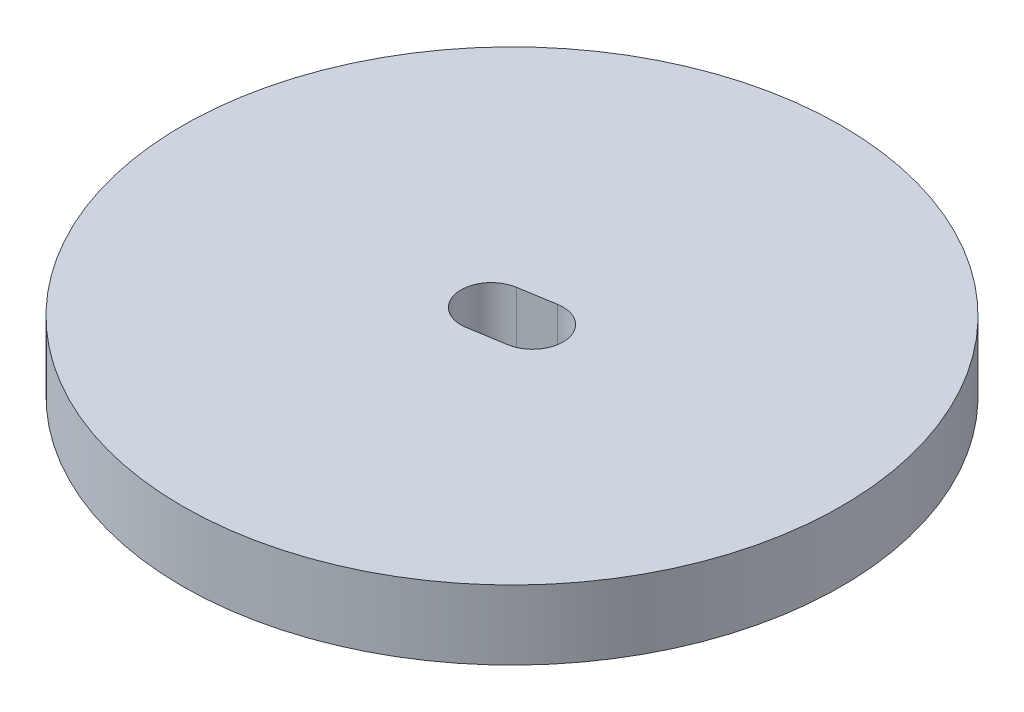
from build123d import *

# Parameters (mm, degrees)
SKETCH_1_R          = 19
EXTRUDE_1_DEPTH     = 4
CUT_EXTRUDE_1_DEPTH = 28.166155414


with BuildPart() as part:
    # ｽｹｯﾁ1 → ﾎﾞｽ - 押し出し1 (new body)
    with BuildSketch(Plane(origin=(0, 0, 0), x_dir=(1, 0, 0), z_dir=(0, 1, 0))):
        with Locations(Location((0, 0, 0), (0, 0, 270))):
            Circle(SKETCH_1_R)
    extrude(amount=EXTRUDE_1_DEPTH)

    # ｽｹｯﾁ2 → ｶｯﾄ - 押し出し1 (cut, through all)
    with BuildSketch(Plane(origin=(0, 4, 0), x_dir=(1, 0, 0), z_dir=(0, 1, 0))):
        with BuildLine():
            Line((-1.306849725, 1.558759919), (0.739448512, 1.894941843))
            ThreePointArc((0.739448512, 1.894941843), (2.75, 0.451791569), (1.306849725, -1.558759919))
            Line((1.306849725, -1.558759919), (-0.739448512, -1.894941843))
            ThreePointArc((-0.739448512, -1.894941843), (-2.75, -0.451791569), (-1.306849725, 1.558759919))
        make_face()
    extrude(amount=-CUT_EXTRUDE_1_DEPTH, mode=Mode.SUBTRACT)


solid = part.part
